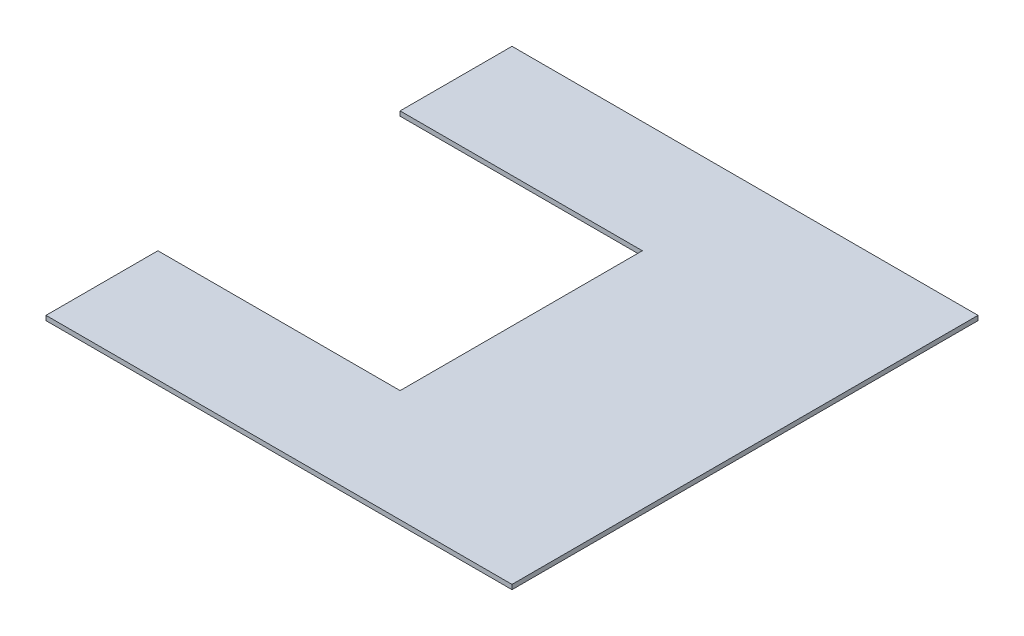
from build123d import *

# Parameters (mm, degrees)
SKETCH1_W           = 202
SKETCH1_H           = 202
BOSS_EXTRUDE1_DEPTH = 2
CUT_EXTRUDE1_REACH  = 144.85
SKETCH2_W           = 105
SKETCH2_H           = 105


with BuildPart() as part:
    # Sketch1 → Boss-Extrude1 (new body)
    with BuildSketch(Plane(origin=(0, 0, 0), x_dir=(1, 0, 0), z_dir=(0, 1, 0))):
        Rectangle(SKETCH1_W, SKETCH1_H)
    extrude(amount=BOSS_EXTRUDE1_DEPTH)

    # Sketch2 → Cut-Extrude1 (cut, up to next)
    with BuildSketch(Plane.XZ, mode=Mode.PRIVATE) as cut_extrude1_sk1:
        with Locations((-48.5, 0)):
            Rectangle(SKETCH2_W, SKETCH2_H)
    cut_extrude1_tool1 = extrude(cut_extrude1_sk1.sketch, amount=-CUT_EXTRUDE1_REACH, mode=Mode.PRIVATE) & part.part
    add(cut_extrude1_tool1.solids().sort_by_distance((-48.5, 0, 0))[0], mode=Mode.SUBTRACT)


solid = part.part
